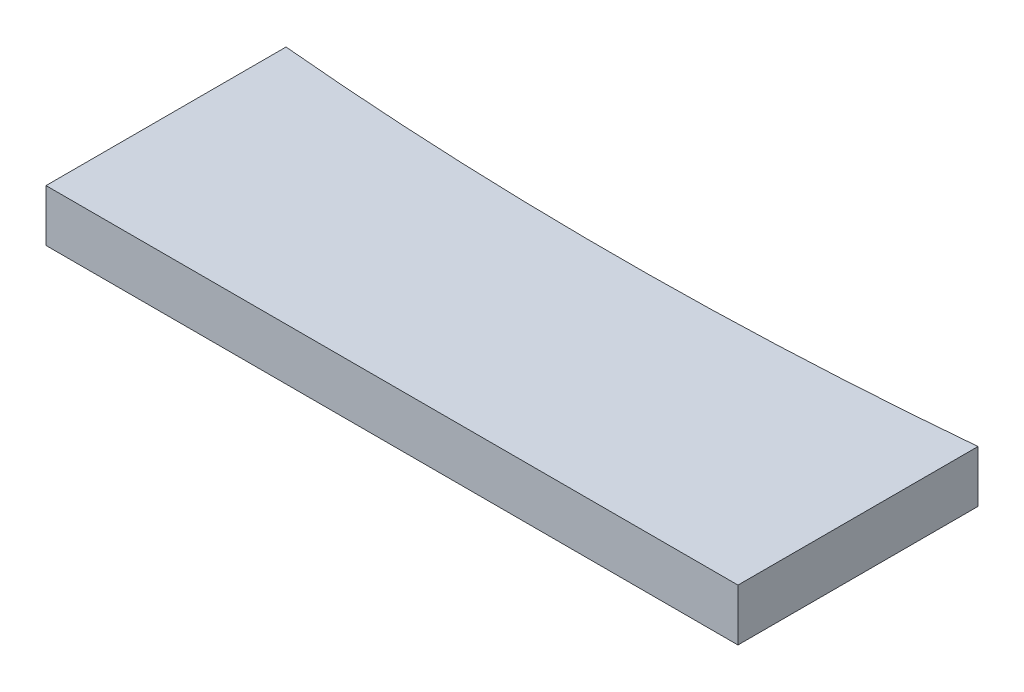
from build123d import *

# Parameters (mm, degrees)
BOSS_EXTRUDE1_DEPTH = 0.762


with BuildPart() as part:
    # Sketch1 → Boss-Extrude1 (new body)
    with BuildSketch(Plane(origin=(0, 0, 0), x_dir=(1, 0, 0), z_dir=(0, 1, 0))):
        with BuildLine():
            ThreePointArc((5.08, -55.329784079), (0, -55.5625), (-5.08, -55.329784079))
            Line((-5.08, -55.329784079), (-5.08, -58.854101994))
            Line((-5.08, -58.854101994), (5.08, -58.854101994))
            Line((5.08, -58.854101994), (5.08, -55.329784079))
        make_face()
    extrude(amount=BOSS_EXTRUDE1_DEPTH)


solid = part.part
